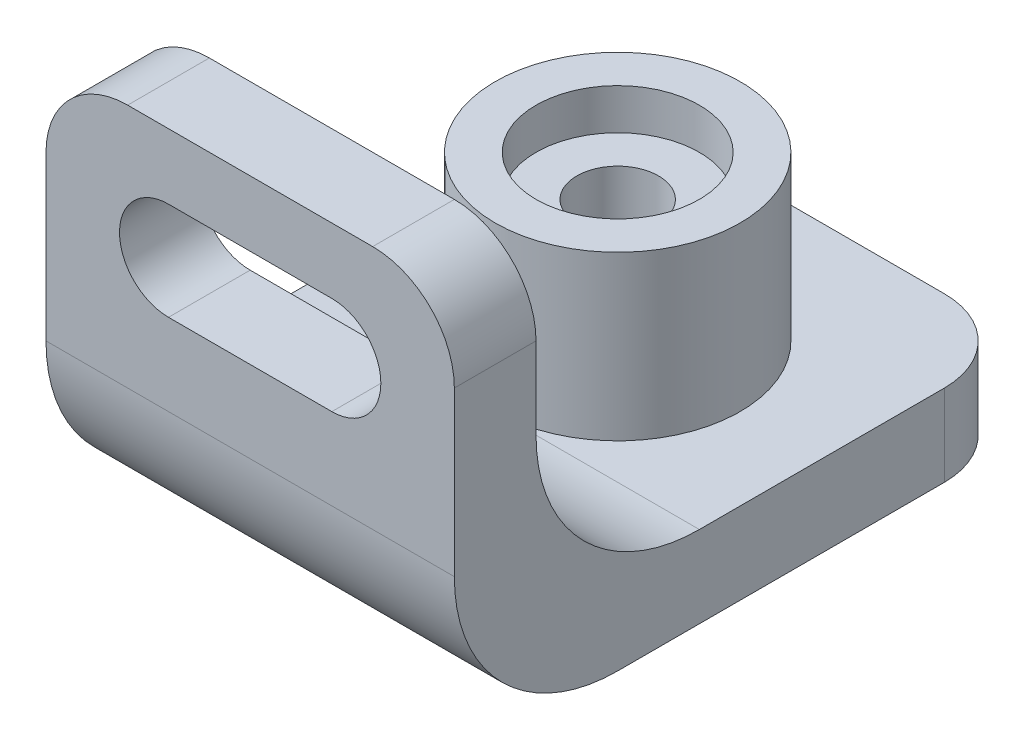
from build123d import *

# Parameters (mm, degrees)
SALIENTE_EXTRUIR1_DEPTH = 50
CORTAR_EXTRUIR1_DEPTH   = 85.263005614
REDONDEO1_R             = 10
REDONDEO2_R             = 10
REDONDEO3_R             = 10
REDONDEO4_R             = 10
CROQUIS5_R              = 15
SALIENTE_EXTRUIR5_DEPTH = 20
CROQUIS7_R              = 10
CORTAR_EXTRUIR3_DEPTH   = 5
CROQUIS9_R              = 5
CORTAR_EXTRUIR4_DEPTH   = 15


with BuildPart() as part:
    # Croquis1 → Saliente-Extruir1 (new body)
    with BuildSketch(Plane(origin=(0, 0, 0), x_dir=(0, 0, -1), z_dir=(1, 0, 0))):
        with BuildLine():
            Line((-33.684210526, 31.626794258), (-33.684210526, 1.626794258))
            ThreePointArc((-33.684210526, 1.626794258), (-27.82634615, -12.515341365), (-13.684210526, -18.373205742))
            Line((-13.684210526, -18.373205742), (36.315789474, -18.373205742))
            Line((36.315789474, -18.373205742), (36.315789474, -8.373205742))
            Line((36.315789474, -8.373205742), (-3.684210526, -8.373205742))
            ThreePointArc((-3.684210526, -8.373205742), (-17.82634615, -2.515341365), (-23.684210526, 11.626794258))
            Line((-23.684210526, 11.626794258), (-23.684210526, 31.626794258))
            Line((-23.684210526, 31.626794258), (-33.684210526, 31.626794258))
        make_face()
    extrude(amount=SALIENTE_EXTRUIR1_DEPTH)

    # Croquis2 → Cortar-Extruir1 (cut, through all)
    with BuildSketch(Plane(origin=(0, 0, 23.684210526), x_dir=(-1, 0, 0), z_dir=(0, 0, -1))):
        with BuildLine():
            Line((-35, 23.626794258), (-15, 23.626794258))
            ThreePointArc((-15, 23.626794258), (-9, 17.626794258), (-15, 11.626794258))
            Line((-15, 11.626794258), (-35, 11.626794258))
            ThreePointArc((-35, 11.626794258), (-41, 17.626794258), (-35, 23.626794258))
        make_face()
    extrude(amount=-CORTAR_EXTRUIR1_DEPTH, mode=Mode.SUBTRACT)

    # Redondeo1
    redondeo1_edges = [part.edges().sort_by_distance(p)[0] for p in [
        (50, 31.626794258, 28.684210526),
    ]]
    fillet(redondeo1_edges, radius=REDONDEO1_R)

    # Redondeo2
    redondeo2_edges = [part.edges().sort_by_distance(p)[0] for p in [
        (0, 31.626794258, 28.684210526),
    ]]
    fillet(redondeo2_edges, radius=REDONDEO2_R)

    # Redondeo3
    redondeo3_edges = [part.edges().sort_by_distance(p)[0] for p in [
        (50, -13.373205742, -36.315789474),
    ]]
    fillet(redondeo3_edges, radius=REDONDEO3_R)

    # Redondeo4
    redondeo4_edges = [part.edges().sort_by_distance(p)[0] for p in [
        (0, -13.373205742, -36.315789474),
    ]]
    fillet(redondeo4_edges, radius=REDONDEO4_R)

    # Croquis5 → Saliente-Extruir5 (add)
    with BuildSketch(Plane(origin=(0, -8.373205742, 0), x_dir=(1, 0, 0), z_dir=(0, 1, 0))):
        with Locations(Location((25, 11.315789474, 0), (0, 0, 270))):
            Circle(CROQUIS5_R)
    extrude(amount=SALIENTE_EXTRUIR5_DEPTH)

    # Croquis7 → Cortar-Extruir3 (cut)
    with BuildSketch(Plane(origin=(0, 11.626794258, 0), x_dir=(1, 0, 0), z_dir=(0, 1, 0))):
        with Locations(Location((25, 11.315789474, 0), (0, 0, 270))):
            Circle(CROQUIS7_R)
    extrude(amount=-CORTAR_EXTRUIR3_DEPTH, mode=Mode.SUBTRACT)

    # Croquis9 → Cortar-Extruir4 (cut)
    with BuildSketch(Plane(origin=(0, 6.626794258, 0), x_dir=(1, 0, 0), z_dir=(0, 1, 0))):
        with Locations(Location((25, 11.315789474, 0), (0, 0, 270))):
            Circle(CROQUIS9_R)
    extrude(amount=-CORTAR_EXTRUIR4_DEPTH, mode=Mode.SUBTRACT)


solid = part.part
